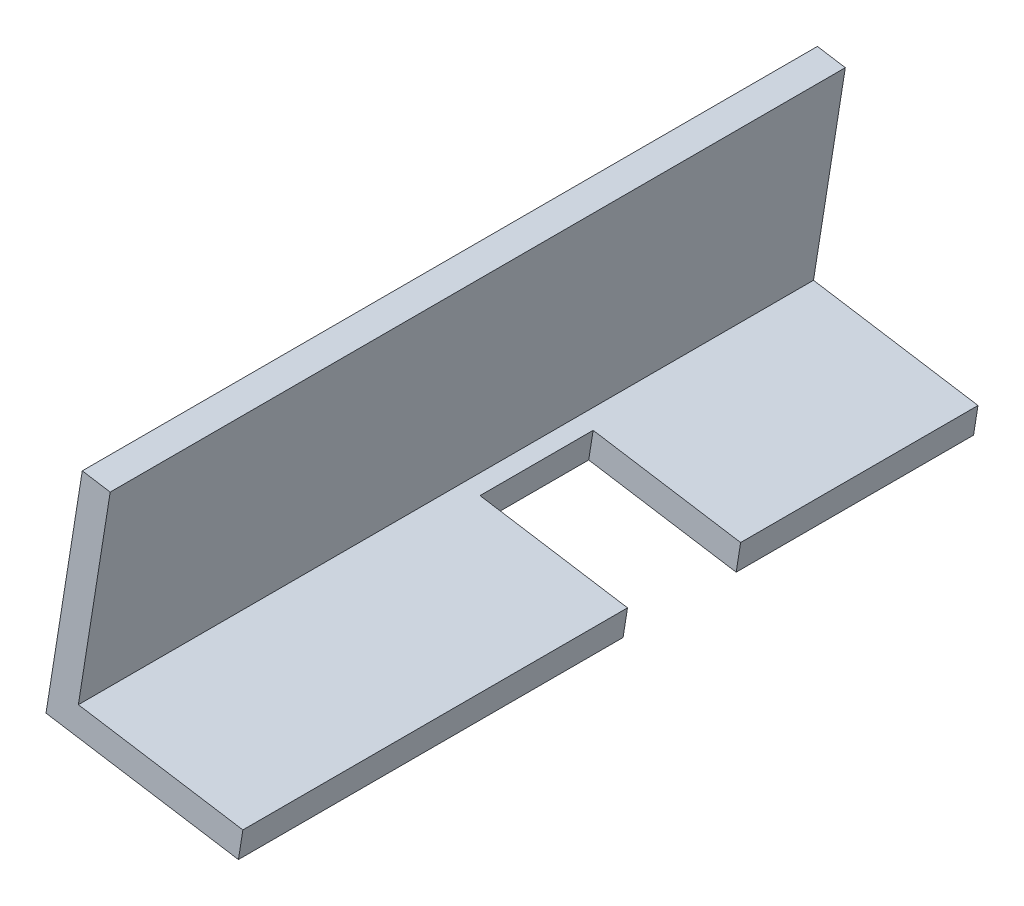
from build123d import *

# Parameters (mm, degrees)
BOSS_EXTRUDE1_DEPTH = 165.1
SKETCH2_W           = 34.115173017
SKETCH2_H           = 25.4
CUT_EXTRUDE1_DEPTH  = 204.055963954


with BuildPart() as part:
    # Sketch1 → Boss-Extrude1 (new body)
    with BuildSketch(Plane.XY):
        Polygon((160.540554754, 279.039764939), (161.538237125, 285.310899596), (124.592919305, 291.188574738), (131.740630622, 336.116962227), (125.469495965, 337.114644598), (118.32158259, 292.186289255), (117.32369816, 285.915186743), align=None)
    extrude(amount=-BOSS_EXTRUDE1_DEPTH)

    # Sketch2 → Cut-Extrude1 (cut, through all)
    with BuildSketch(Plane(origin=(48.257589409, 303.332854378, 0), x_dir=(0.9875802609456015, -0.15711533404037248, 0), z_dir=(0.15711533404037245, 0.9875802609456014, 0))):
        with Locations((98.225905587, 99.088343442)):
            Rectangle(SKETCH2_W, SKETCH2_H)
    extrude(amount=-CUT_EXTRUDE1_DEPTH, mode=Mode.SUBTRACT)


solid = part.part
